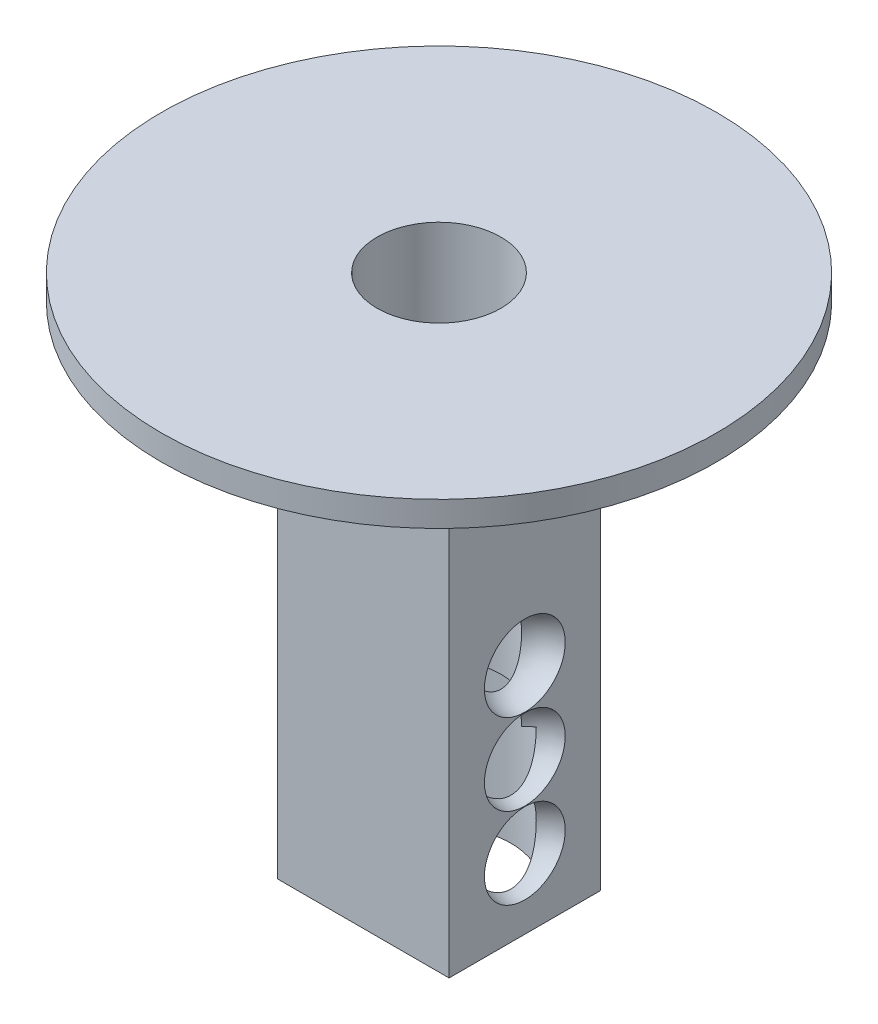
from build123d import *
from build123d.topology import SkipClean

# Parameters (mm, degrees)
SKETCH_5_W                 = 17
SKETCH_5_H                 = 100
EXTRUDE_1_DEPTH            = 15
PATTERN_LINEAR_1_COUNT     = 2
PATTERN_LINEAR_1_PITCH     = 16.1
PATTERN_LINEAR_1_COL_COUNT = 2
PATTERN_LINEAR_1_COL_PITCH = 16.1
SKETCH_9_W                 = 55
SKETCH_9_H                 = 5
CUT_EXTRUDE_1_DEPTH        = 109.050913925
CUT_EXTRUDE_1_DEPTH_BACK   = 109.050913925
SKETCH_12_R                = 12.25
SKETCH_15_R                = 14.25
CUT_EXTRUDE_4_DEPTH        = 109.050913994


with BuildPart() as part:
    # 草图5 → 凸台-拉伸1 (new, symmetric)
    with BuildSketch(Plane.XY):
        with Locations((-8.5, 20)):
            Rectangle(SKETCH_5_W, SKETCH_5_H)
    extrude_1 = extrude(amount=EXTRUDE_1_DEPTH, both=True)

    # 草图7 → 切除-旋转1 (revolve, cut)
    with BuildSketch(Plane.XY):
        with BuildLine():
            Line((-17, 8), (-17, -8))
            ThreePointArc((-17, -8), (-9, 0), (-17, 8))
        make_face()
    cut_revolve_1 = revolve(axis=Axis((-17, 8, 0), (0, -1, 0)), mode=Mode.SUBTRACT)

    # 阵列(线性)1: 切除-旋转1 ×2
    with Locations(*[(0, i * PATTERN_LINEAR_1_PITCH, 0) for i in range(1, PATTERN_LINEAR_1_COUNT)]):
        add(cut_revolve_1, mode=Mode.SUBTRACT)

    # 阵列(线性)1 col: 切除-旋转1 ×2
    with Locations(*[(0, -i * PATTERN_LINEAR_1_COL_PITCH, 0) for i in range(1, PATTERN_LINEAR_1_COL_COUNT)]):
        add(cut_revolve_1, mode=Mode.SUBTRACT)

    # 镜向2: 凸台-拉伸1 across plane
    add(extrude_1.mirror(Plane(origin=(0, 0, 0), x_dir=(0, 0, 1), z_dir=(1, 0, 0))))

    # 镜向3: 切除-旋转1 across plane
    with SkipClean():  # the faces are left unmerged after this step: merging them gives an invalid solid
        add(cut_revolve_1.mirror(Plane(origin=(0, 0, 0), x_dir=(0, 0, 1), z_dir=(1, 0, 0))), mode=Mode.SUBTRACT)

    # 镜向4 copy 1 sketch → 镜向4 copy 1 (revolve, cut)
    with SkipClean():  # the faces are left unmerged after this step: merging them gives an invalid solid
        with BuildSketch(Plane(origin=(0, 16.1, 0), x_dir=(-1, 0, 0), z_dir=(0, 0, 1))):
            with BuildLine():
                Line((-17, -8), (-17, 8))
                ThreePointArc((-17, 8), (-9, 0), (-17, -8))
            make_face()
        revolve(axis=Axis((17, 24.1, 0), (0, 1, 0)), mode=Mode.SUBTRACT)

    # 镜向4 copy 2 sketch → 镜向4 copy 2 (revolve, cut)
    with SkipClean():  # the faces are left unmerged after this step: merging them gives an invalid solid
        with BuildSketch(Plane(origin=(0, -16.1, 0), x_dir=(-1, 0, 0), z_dir=(0, 0, 1))):
            with BuildLine():
                Line((-17, -8), (-17, 8))
                ThreePointArc((-17, 8), (-9, 0), (-17, -8))
            make_face()
        revolve(axis=Axis((17, -8.1, 0), (0, 1, 0)), mode=Mode.SUBTRACT)

    # 镜向4 copy 3 sketch → 镜向4 copy 3 (revolve, cut)
    with SkipClean():  # the faces are left unmerged after this step: merging them gives an invalid solid
        with BuildSketch(Plane(origin=(0, 0, 0), x_dir=(-1, 0, 0), z_dir=(0, 0, 1))):
            with BuildLine():
                Line((-17, -8), (-17, 8))
                ThreePointArc((-17, 8), (-9, 0), (-17, -8))
            make_face()
        revolve(axis=Axis((17, 8, 0), (0, 1, 0)), mode=Mode.SUBTRACT)

    # 草图9 → 旋转1 (revolve)
    with SkipClean():  # the faces are left unmerged after this step: merging them gives an invalid solid
        with BuildSketch(Plane.XY):
            with Locations((27.5, 72.5)):
                Rectangle(SKETCH_9_W, SKETCH_9_H)
        revolve(axis=Axis((0, 70, 0), (0, 1, 0)))

    # 草图12 → 切除-拉伸1 (cut, two sides: drawn at the far end of the back side and taken through both)
    with SkipClean():  # the faces are left unmerged after this step: merging them gives an invalid solid
        with BuildSketch(Plane(origin=(0, 0, 0), x_dir=(1, 0, 0), z_dir=(0, 1, 0)).offset(-CUT_EXTRUDE_1_DEPTH_BACK)):
            Circle(SKETCH_12_R)
        extrude(amount=CUT_EXTRUDE_1_DEPTH + CUT_EXTRUDE_1_DEPTH_BACK, mode=Mode.SUBTRACT)

    # 草图15 → 切除-拉伸4 (cut, through all)
    with SkipClean():  # the faces are left unmerged after this step: merging them gives an invalid solid
        with BuildSketch(Plane(origin=(0, 0, 0), x_dir=(1, 0, 0), z_dir=(0, 1, 0))):
            Circle(SKETCH_15_R)
        extrude(amount=-CUT_EXTRUDE_4_DEPTH, mode=Mode.SUBTRACT)


solid = part.part
